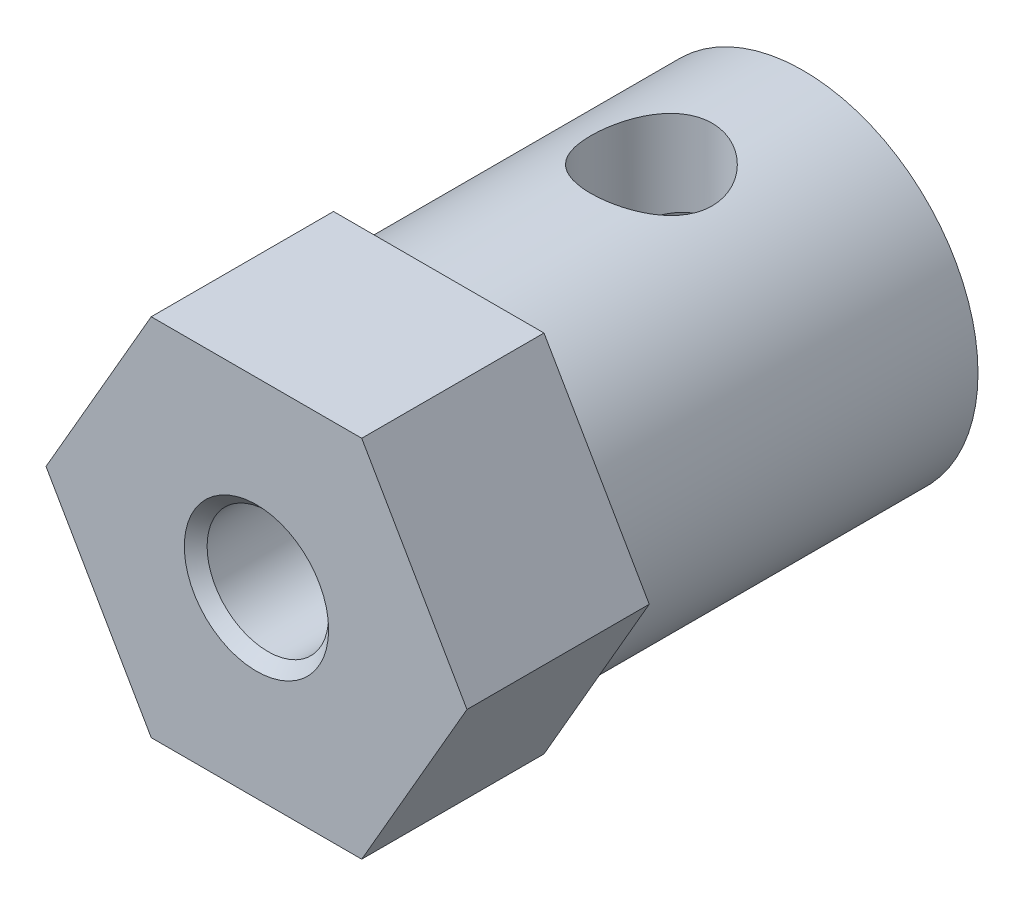
from build123d import *

# Parameters (mm, degrees)
EXTRUDE_1_DEPTH              = 6
SKETCH_2_W                   = 5.75
SKETCH_2_H                   = 12
HOLE_WIZARD_M4_1_D           = 4
HOLE_WIZARD_M4_1_CBORE_D     = 6
HOLE_WIZARD_M4_1_CBORE_DEPTH = 12
SKETCH_7_R                   = 2
CUT_EXTRUDE_1_DEPTH          = 19.167622299
CHAMFER_1_SIZE               = 0.375


with BuildPart() as part:
    # 草图1 → 凸台-拉伸1 (new body)
    with BuildSketch(Plane.XY.offset(6)):
        Polygon((-3.464101615, -6), (3.464101615, -6), (6.92820323, 0), (3.464101615, 6), (-3.464101615, 6), (-6.92820323, 0), align=None)
    extrude(amount=-EXTRUDE_1_DEPTH)

    # 草图2 → 旋转1 (revolve)
    with BuildSketch(Plane(origin=(0, 0, 0), x_dir=(1, 0, 0), z_dir=(0, 1, 0))):
        with Locations((2.875, 6)):
            Rectangle(SKETCH_2_W, SKETCH_2_H)
    revolve(axis=Axis((0, 0, -12), (0, 0, 1)))

    # M4 六角头机械螺钉的柱形沉头孔1 (through all)
    with Locations(Plane(origin=(0, 0, -12), x_dir=(-1, 0, 0), z_dir=(0, 0, -1))):
        with Locations((0, 0)):
            CounterBoreHole(HOLE_WIZARD_M4_1_D / 2, HOLE_WIZARD_M4_1_CBORE_D / 2, HOLE_WIZARD_M4_1_CBORE_DEPTH)

    # 草图7 → 切除-拉伸1 (cut, through all)
    with BuildSketch(Plane(origin=(0, 5.75, 0), x_dir=(1, 0, 0), z_dir=(0, 1, 0))):
        with Locations(Location((0, 7, 0), (0, 0, 270))):
            Circle(SKETCH_7_R)
    extrude(amount=-CUT_EXTRUDE_1_DEPTH, mode=Mode.SUBTRACT)

    # 倒角1
    chamfer_1_edges = [part.edges().sort_by_distance(p)[0] for p in [
        (-2, 0, 6),
    ]]
    chamfer(chamfer_1_edges, length=CHAMFER_1_SIZE)


solid = part.part
